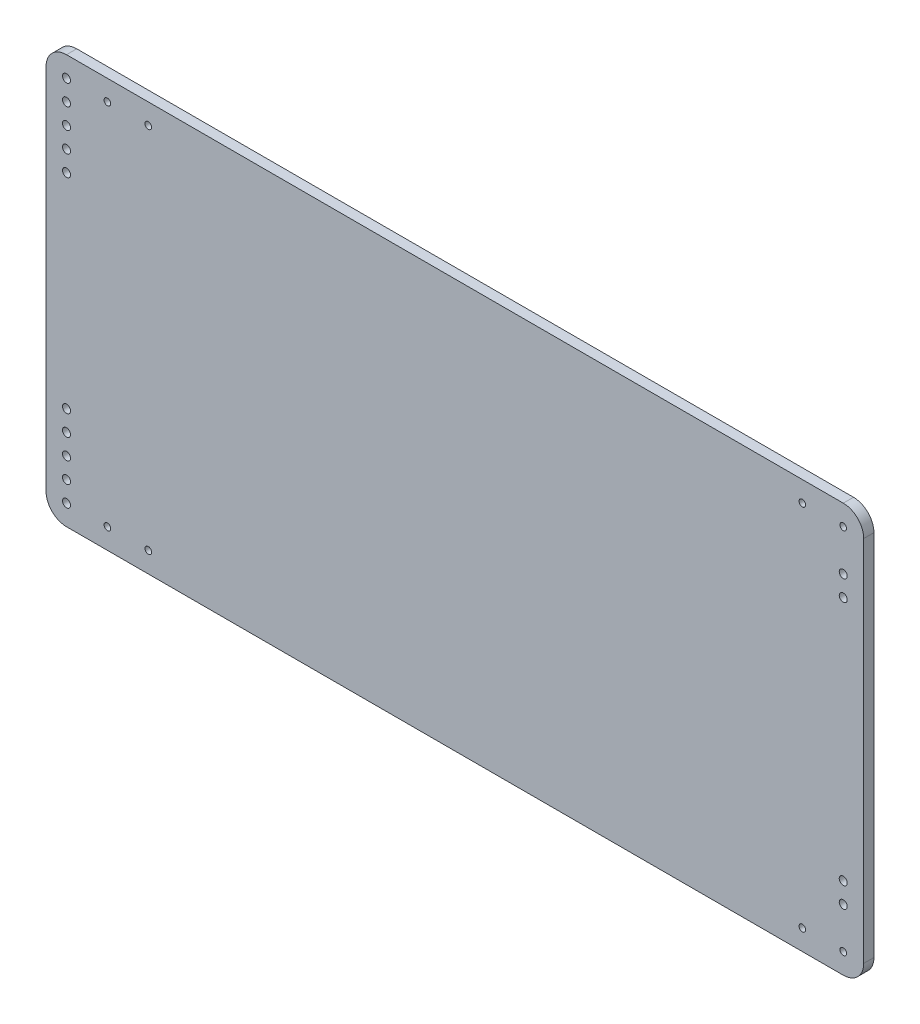
from build123d import *

# Parameters (mm, degrees)
BOSS_EXTRUDE1_DEPTH = 6.35
SKETCH2_R           = 2.5
SKETCH2_R_2         = 2.4892
SKETCH2_R_3         = 2.0701
CUT_EXTRUDE1_DEPTH  = 568.996762755
SKETCH3_R           = 2.0701
SKETCH3_R_2         = 2.4892
CUT_EXTRUDE2_DEPTH  = 568.996762755


with BuildPart() as part:
    # Sketch1 → Boss-Extrude1 (new body)
    with BuildSketch(Plane.XY):
        with BuildLine():
            Line((12.7, 0), (495.3, 0))
            ThreePointArc((495.3, 0), (504.280256121, 3.719743879), (508, 12.7))
            Line((508, 12.7), (508, 241.3))
            ThreePointArc((508, 241.3), (504.280256121, 250.280256121), (495.3, 254))
            Line((495.3, 254), (12.7, 254))
            ThreePointArc((12.7, 254), (3.719743879, 250.280256121), (0, 241.3))
            Line((0, 241.3), (0, 12.7))
            ThreePointArc((0, 12.7), (3.719743879, 3.719743879), (12.7, 0))
        make_face()
    extrude(amount=BOSS_EXTRUDE1_DEPTH)

    # Sketch2 → Cut-Extrude1 (cut, through all)
    with BuildSketch(Plane.XY.offset(6.35)):
        with Locations((12.7, 190.5)):
            Circle(SKETCH2_R)
        with Locations((12.7, 203.2)):
            Circle(SKETCH2_R)
        with Locations((12.7, 215.9)):
            Circle(SKETCH2_R)
        with Locations((12.7, 228.6)):
            Circle(SKETCH2_R)
        with Locations((12.7, 241.3)):
            Circle(SKETCH2_R_2)
        with Locations((38.1, 241.3)):
            Circle(SKETCH2_R_3)
        with Locations((63.5, 241.3)):
            Circle(SKETCH2_R_3)
        with Locations(Location((63.5, 12.7, 0), (0, 0, 180))):
            Circle(SKETCH2_R_3)
        with Locations(Location((38.1, 12.7, 0), (0, 0, 180))):
            Circle(SKETCH2_R_3)
        with Locations(Location((12.7, 63.5, 0), (0, 0, 180))):
            Circle(SKETCH2_R)
        with Locations(Location((12.7, 50.8, 0), (0, 0, 180))):
            Circle(SKETCH2_R)
        with Locations(Location((12.7, 38.1, 0), (0, 0, 180))):
            Circle(SKETCH2_R)
        with Locations(Location((12.7, 25.4, 0), (0, 0, 180))):
            Circle(SKETCH2_R)
        with Locations(Location((12.7, 12.7, 0), (0, 0, 180))):
            Circle(SKETCH2_R_2)
    extrude(amount=-CUT_EXTRUDE1_DEPTH, mode=Mode.SUBTRACT)

    # Sketch3 → Cut-Extrude2 (cut, through all)
    with BuildSketch(Plane.XY.offset(6.35)):
        with Locations((469.879454624, 241.3)):
            Circle(SKETCH3_R)
        with Locations((495.279454624, 241.3)):
            Circle(SKETCH3_R)
        with Locations((495.279454624, 215.9)):
            Circle(SKETCH3_R_2)
        with Locations((495.279454624, 203.2)):
            Circle(SKETCH3_R_2)
        with Locations(Location((469.879454624, 12.7, 0), (0, 0, 180))):
            Circle(SKETCH3_R)
        with Locations(Location((495.279454624, 12.7, 0), (0, 0, 180))):
            Circle(SKETCH3_R)
        with Locations(Location((495.279454624, 38.1, 0), (0, 0, 180))):
            Circle(SKETCH3_R_2)
        with Locations(Location((495.279454624, 50.8, 0), (0, 0, 180))):
            Circle(SKETCH3_R_2)
    extrude(amount=-CUT_EXTRUDE2_DEPTH, mode=Mode.SUBTRACT)


solid = part.part
